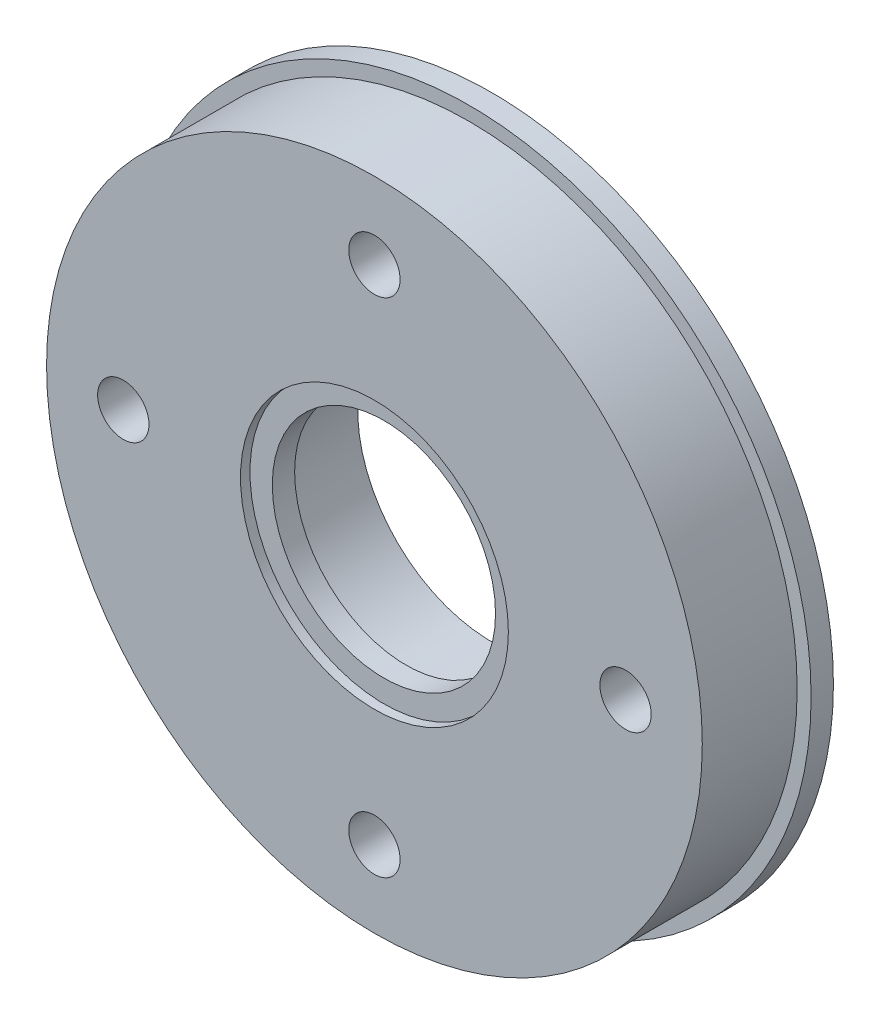
from build123d import *

# Parameters (mm, degrees)
SKETCH1_R           = 30.625
SKETCH1_R_2         = 29.375
SKETCH1_R_3         = 12
BOSS_EXTRUDE1_DEPTH = 2
BOSS_EXTRUDE2_START = 2
SKETCH1_3_R         = 29.375
SKETCH1_3_R_2       = 12
BOSS_EXTRUDE2_DEPTH = 8.5
BOSS_EXTRUDE3_START = 7.65
SKETCH1_4_R         = 12
SKETCH1_4_R_2       = 10
BOSS_EXTRUDE3_DEPTH = 2
SKETCH2_R           = 2.3
CUT_EXTRUDE1_DEPTH  = 9


with BuildPart() as part:
    # Sketch1 → Boss-Extrude1 (new body)
    # profile 1 of 2: a face of its own
    with BuildSketch(Plane.XY):
        Circle(SKETCH1_R)
        Circle(SKETCH1_R_2, mode=Mode.SUBTRACT)
    # profile 2 of 2: a face of its own
    with BuildSketch(Plane.XY):
        Circle(SKETCH1_R_2)
        Circle(SKETCH1_R_3, mode=Mode.SUBTRACT)
    extrude(amount=BOSS_EXTRUDE1_DEPTH)

    # Sketch1<3> → Boss-Extrude2 (add)
    with BuildSketch(Plane.XY.offset(BOSS_EXTRUDE2_START)):
        Circle(SKETCH1_3_R)
        Circle(SKETCH1_3_R_2, mode=Mode.SUBTRACT)
    extrude(amount=BOSS_EXTRUDE2_DEPTH)

    # Sketch1<4> → Boss-Extrude3 (add)
    with BuildSketch(Plane.XY.offset(BOSS_EXTRUDE3_START)):
        Circle(SKETCH1_4_R)
        Circle(SKETCH1_4_R_2, mode=Mode.SUBTRACT)
    extrude(amount=BOSS_EXTRUDE3_DEPTH)

    # Sketch2 → Cut-Extrude1 (cut)
    with BuildSketch(Plane.XY.offset(10.5)):
        with Locations((0, 22.5)):
            Circle(SKETCH2_R)
        with Locations((22.5, 0)):
            Circle(SKETCH2_R)
        with Locations((0, -22.5)):
            Circle(SKETCH2_R)
        with Locations((-22.5, 0)):
            Circle(SKETCH2_R)
    extrude(amount=-CUT_EXTRUDE1_DEPTH, mode=Mode.SUBTRACT)


solid = part.part
